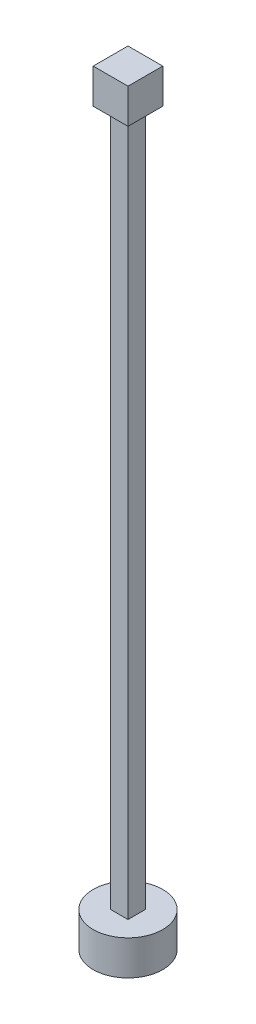
from build123d import *

# Parameters (mm, degrees)
SKETCH1_R           = 50
BOSS_EXTRUDE1_DEPTH = 50
SKETCH2_W           = 25
SKETCH2_H           = 25
BOSS_EXTRUDE2_DEPTH = 1000
SKETCH3_W           = 50
SKETCH3_H           = 50
BOSS_EXTRUDE3_DEPTH = 50


with BuildPart() as part:
    # Sketch1 → Boss-Extrude1 (new body)
    with BuildSketch(Plane(origin=(0, 0, 0), x_dir=(1, 0, 0), z_dir=(0, 1, 0))):
        with Locations(Location((0, 0, 0), (0, 0, 270))):
            Circle(SKETCH1_R)
    extrude(amount=BOSS_EXTRUDE1_DEPTH)

    # Sketch2 → Boss-Extrude2 (add)
    with BuildSketch(Plane(origin=(0, 50, 0), x_dir=(1, 0, 0), z_dir=(0, 1, 0))):
        Rectangle(SKETCH2_W, SKETCH2_H)
    extrude(amount=BOSS_EXTRUDE2_DEPTH)

    # Sketch3 → Boss-Extrude3 (add)
    with BuildSketch(Plane(origin=(0, 1050, 0), x_dir=(1, 0, 0), z_dir=(0, 1, 0))):
        Rectangle(SKETCH3_W, SKETCH3_H)
    extrude(amount=BOSS_EXTRUDE3_DEPTH)


solid = part.part
